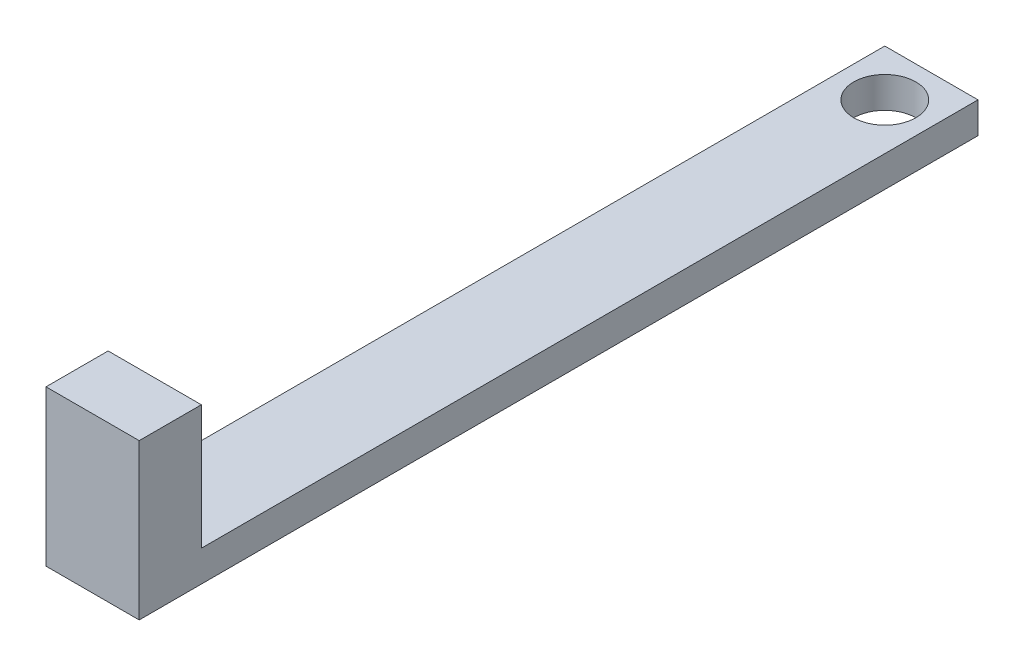
from build123d import *

# Parameters (mm, degrees)
BOSS_EXTRUDE1_DEPTH = 30
SKETCH2_R           = 10
CUT_EXTRUDE1_DEPTH  = 10


with BuildPart() as part:
    # Sketch1 → Boss-Extrude1 (new body)
    with BuildSketch(Plane(origin=(0, 0, 0), x_dir=(0, 0, -1), z_dir=(1, 0, 0))):
        Polygon((0, 40), (0, 0), (250, 0), (250, -10), (-20, -10), (-20, 40), align=None)
    extrude(amount=BOSS_EXTRUDE1_DEPTH)

    # Sketch2 → Cut-Extrude1 (cut)
    with BuildSketch(Plane(origin=(0, 0, 0), x_dir=(1, 0, 0), z_dir=(0, 1, 0))):
        with Locations(Location((15, 235, 0), (0, 0, 270))):
            Circle(SKETCH2_R)
    extrude(amount=-CUT_EXTRUDE1_DEPTH, mode=Mode.SUBTRACT)


solid = part.part
